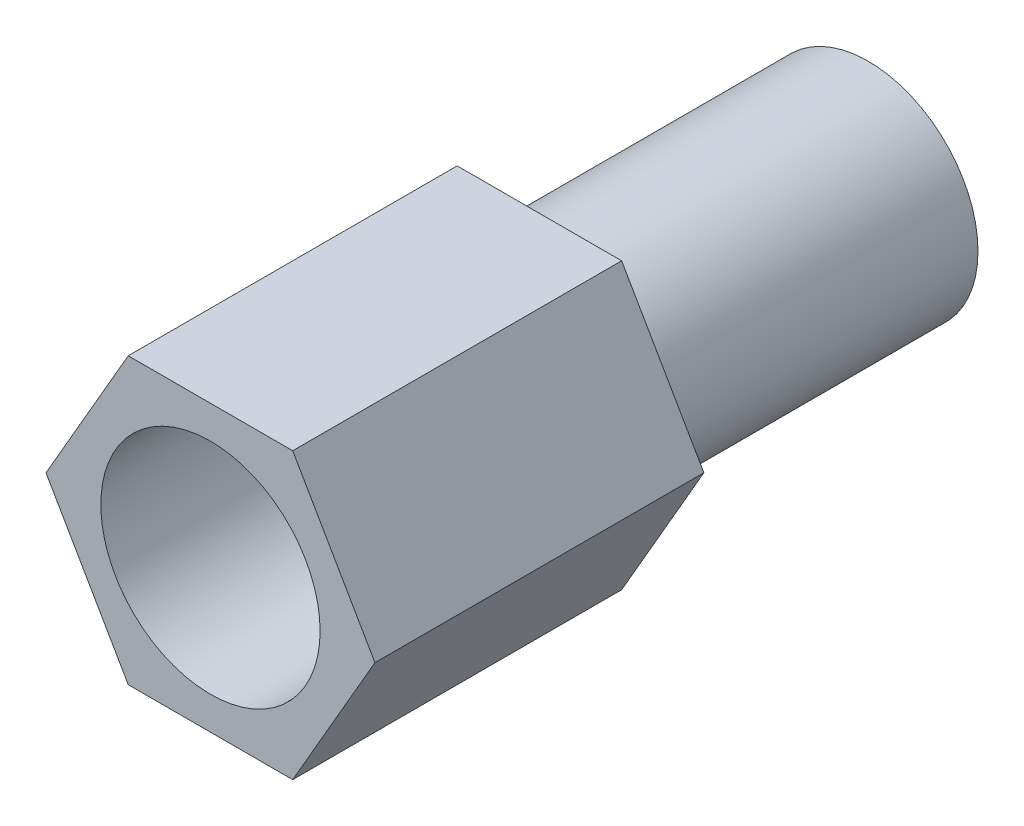
from build123d import *

# Parameters (mm, degrees)
SKETCH_1_R      = 1
EXTRUDE_1_DEPTH = 3
SKETCH_2_R      = 1
EXTRUDE_2_DEPTH = 3


with BuildPart() as part:
    # 草图1 → 凸台-拉伸1 (new body)
    with BuildSketch(Plane.XY):
        Polygon((-1.5, 0), (-0.75, -1.299038106), (0.75, -1.299038106), (1.5, 0), (0.75, 1.299038106), (-0.75, 1.299038106), align=None)
        Circle(SKETCH_1_R, mode=Mode.SUBTRACT)
    extrude(amount=EXTRUDE_1_DEPTH)


with BuildPart() as body_2:
    # 草图2 → 凸台-拉伸2 (new body)
    with BuildSketch(Plane.XY):
        Circle(SKETCH_2_R)
    extrude(amount=-EXTRUDE_2_DEPTH)


solid = Compound([part.part, body_2.part])
